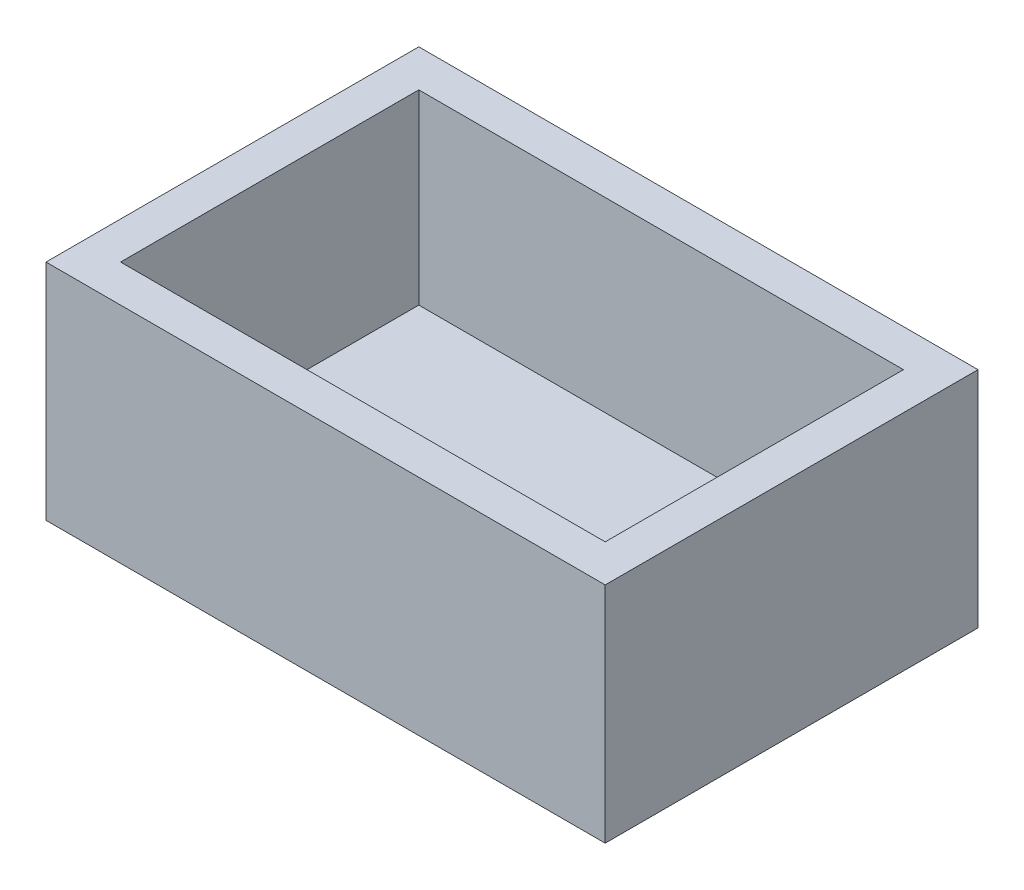
from build123d import *

# Parameters (mm, degrees)
SKETCH1_W           = 150
SKETCH1_H           = 100
BOSS_EXTRUDE1_DEPTH = 60
SKETCH2_W           = 130
SKETCH2_H           = 80
CUT_EXTRUDE1_DEPTH  = 50


with BuildPart() as part:
    # Sketch1 → Boss-Extrude1 (new body)
    with BuildSketch(Plane(origin=(0, 0, 0), x_dir=(1, 0, 0), z_dir=(0, 1, 0))):
        Rectangle(SKETCH1_W, SKETCH1_H)
    extrude(amount=BOSS_EXTRUDE1_DEPTH)

    # Sketch2 → Cut-Extrude1 (cut)
    with BuildSketch(Plane(origin=(0, 60, 0), x_dir=(1, 0, 0), z_dir=(0, 1, 0))):
        Rectangle(SKETCH2_W, SKETCH2_H)
    extrude(amount=-CUT_EXTRUDE1_DEPTH, mode=Mode.SUBTRACT)


solid = part.part
